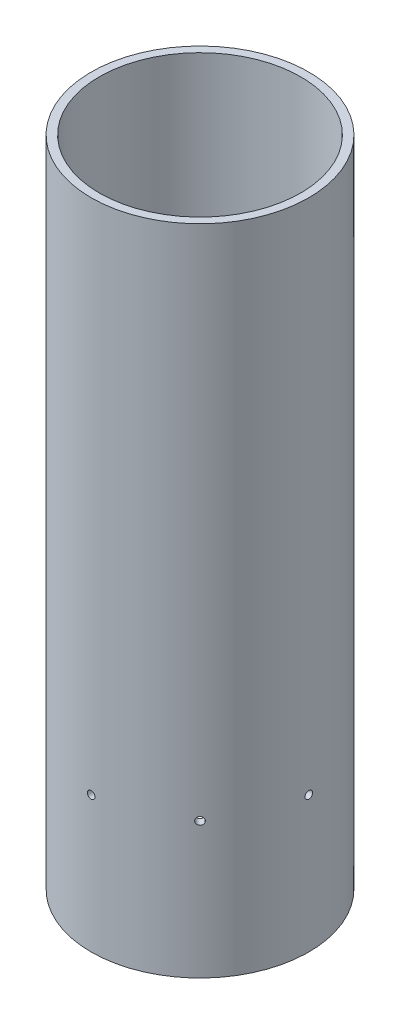
from build123d import *

# Parameters (mm, degrees)
SKETCH1_R                   = 50.8
SKETCH1_R_2                 = 46.99
BOSS_EXTRUDE1_DEPTH         = 304.8
BULKHEAD_HOLES_REACH        = 327.279
BULKHEAD_HOLES_END_RADIUS   = 46.99
SKETCH2_R                   = 1.7526
BULKHEAD_HOLE_PATTERN_COUNT = 8


with BuildPart() as part:
    # Sketch1 → Boss-Extrude1 (new body)
    with BuildSketch(Plane(origin=(0, 0, 0), x_dir=(1, 0, 0), z_dir=(0, 1, 0))):
        with Locations(Location((0, 0, 0), (0, 0, 90))):
            Circle(SKETCH1_R)
        with Locations(Location((0, 0, 0), (0, 0, 90))):
            Circle(SKETCH1_R_2, mode=Mode.SUBTRACT)
    extrude(amount=BOSS_EXTRUDE1_DEPTH)

    # Bulkhead Holes: up to this cylinder (the profile starts outside it)
    bulkhead_holes_end = Plane(origin=(0, 63.5, 0), z_dir=(0, -1, 0)) * Cylinder(BULKHEAD_HOLES_END_RADIUS, 749.538, mode=Mode.PRIVATE)
    # Sketch2 → Bulkhead Holes (cut, up to the surface)
    with BuildSketch(Plane(origin=(50.8, 0, 0), x_dir=(0, 0, -1), z_dir=(1, 0, 0)), mode=Mode.PRIVATE) as bulkhead_holes_sk1:
        with Locations((0, 63.5)):
            Circle(SKETCH2_R)
    bulkhead_holes_tool1 = extrude(bulkhead_holes_sk1.sketch, amount=-BULKHEAD_HOLES_REACH, mode=Mode.PRIVATE) - bulkhead_holes_end
    bulkhead_holes = bulkhead_holes_tool1.solids().sort_by_distance((50.8, 63.5, 0))[0]
    add(bulkhead_holes, mode=Mode.SUBTRACT)

    # Bulkhead Hole Pattern: Bulkhead Holes ×8 about axis
    bulkhead_hole_pattern_axis = Axis((0, 0, 0), (0, 1, 0))
    for i in range(1, BULKHEAD_HOLE_PATTERN_COUNT):
        add(bulkhead_holes.rotate(bulkhead_hole_pattern_axis, i * 360 / BULKHEAD_HOLE_PATTERN_COUNT), mode=Mode.SUBTRACT)


solid = part.part
